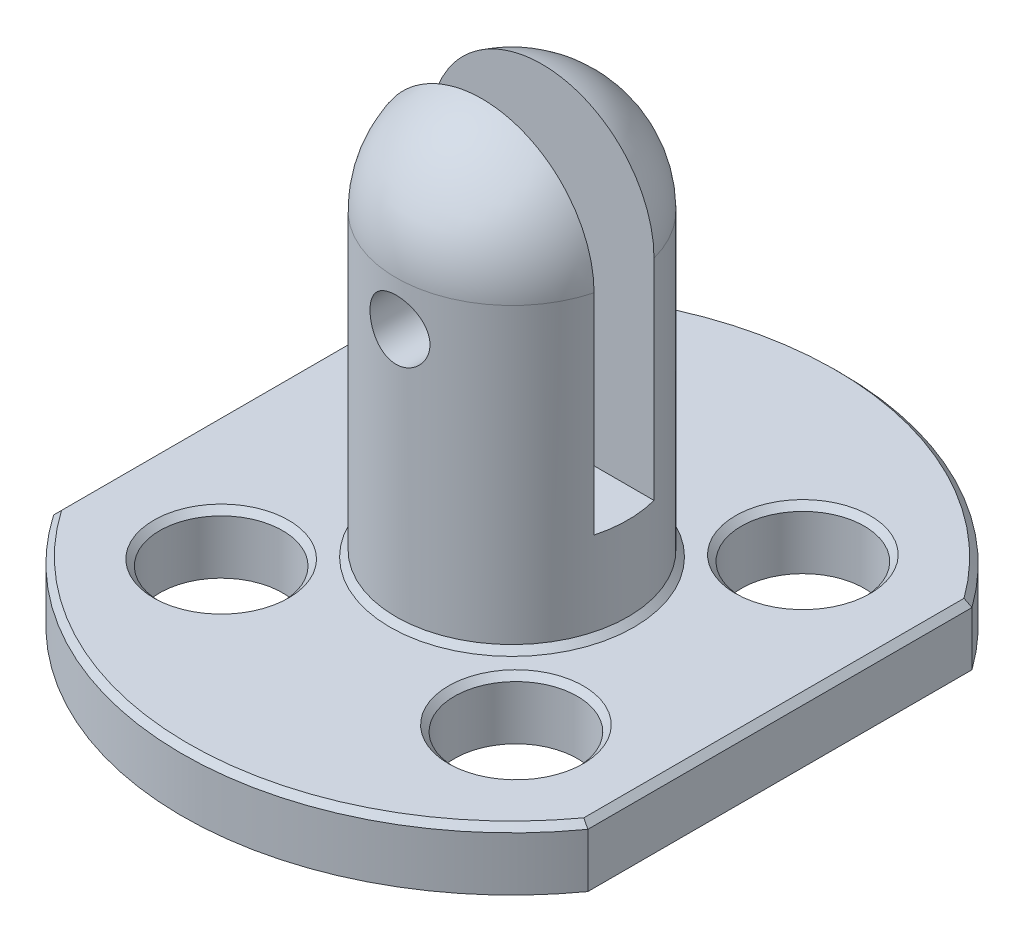
from build123d import *

# Parameters (mm, degrees)
SKETCH1_R               = 2.05
BOSS_EXTRUDE1_DEPTH     = 2
SKETCH2_R               = 3.87
BOSS_EXTRUDE2_DEPTH     = 10
SKETCH4_R               = 3
BOSS_EXTRUDE3_DEPTH     = 1
CUT_EXTRUDE2_DEPTH      = 15
CUT_EXTRUDE3_DEPTH      = 22.231780641
CUT_EXTRUDE3_DEPTH_BACK = 22.231780641
SKETCH9_R               = 1
CHAMFER1_SIZE           = 0.2


with BuildPart() as part:
    # Sketch1 → Boss-Extrude1 (new body)
    with BuildSketch(Plane(origin=(0, 0, 0), x_dir=(1, 0, 0), z_dir=(0, 1, 0))):
        with BuildLine():
            Line((-9.06012954, 6.238112913), (-9.06012954, -6.238112913))
            ThreePointArc((-9.06012954, -6.238112913), (-0.104590041, -10.999502758), (8.93987046, -6.40926799))
            Line((8.93987046, -6.40926799), (8.93987046, 6.40926799))
            ThreePointArc((8.93987046, 6.40926799), (-0.104590041, 10.999502758), (-9.06012954, 6.238112913))
        make_face()
        with Locations(Location((-4.917973081, 4.788086362, 0), (0, 0, 270))):
            Circle(SKETCH1_R, mode=Mode.SUBTRACT)
        with Locations(Location((4.788086362, 4.917973081, 0), (0, 0, 270))):
            Circle(SKETCH1_R, mode=Mode.SUBTRACT)
        with Locations(Location((4.917973081, -4.788086362, 0), (0, 0, 270))):
            Circle(SKETCH1_R, mode=Mode.SUBTRACT)
        with Locations(Location((-4.788086362, -4.917973081, 0), (0, 0, 270))):
            Circle(SKETCH1_R, mode=Mode.SUBTRACT)
    extrude(amount=BOSS_EXTRUDE1_DEPTH)

    # Sketch2 → Boss-Extrude2 (add)
    with BuildSketch(Plane(origin=(0, 2, 0), x_dir=(1, 0, 0), z_dir=(0, 1, 0))):
        with Locations(Location((0, 0, 0), (0, 0, 270))):
            Circle(SKETCH2_R)
    extrude(amount=BOSS_EXTRUDE2_DEPTH)

    # Sketch3 → Revolve1 (revolve)
    with BuildSketch(Plane.XY):
        with BuildLine():
            Line((0, 15.87), (0, 12))
            Line((0, 12), (3.87, 12))
            ThreePointArc((3.87, 12), (2.736503243, 14.736503243), (0, 15.87))
        make_face()
    revolve(axis=Axis((0, 15.87, 0), (0, -1, 0)))

    # Sketch4 → Boss-Extrude3 (add)
    with BuildSketch(Plane.XZ):
        with Locations(Location((0, 0, 0), (0, 0, 270))):
            Circle(SKETCH4_R)
    extrude(amount=BOSS_EXTRUDE3_DEPTH)

    # Sketch7 → Cut-Extrude2 (cut)
    with BuildSketch(Plane(origin=(0, 20, 0), x_dir=(1, 0, 0), z_dir=(0, 1, 0))):
        with BuildLine():
            Line((-7.332454233, 1), (7.579147316, 1))
            ThreePointArc((7.579147316, 1), (8.579147316, 0), (7.579147316, -1))
            Line((7.579147316, -1), (-7.332454233, -1))
            ThreePointArc((-7.332454233, -1), (-8.332454233, 0), (-7.332454233, 1))
        make_face()
    extrude(amount=-CUT_EXTRUDE2_DEPTH, mode=Mode.SUBTRACT)

    # Sketch9 → Cut-Extrude3 (cut, two sides: drawn at the far end of the back side and taken through both)
    with BuildSketch(Plane.XY.offset(-CUT_EXTRUDE3_DEPTH_BACK)):
        with Locations((0, 10.5)):
            Circle(SKETCH9_R)
    extrude(amount=CUT_EXTRUDE3_DEPTH + CUT_EXTRUDE3_DEPTH_BACK, mode=Mode.SUBTRACT)

    # Chamfer1
    chamfer1_edges = [part.edges().sort_by_distance(p)[0] for p in [
        (-4.917973081, 2, -6.838086362),
        (-0.104590041, 2, 10.999502758),
        (4.788086362, 2, -6.967973081),
        (8.93987046, 2, 0),
        (4.917973081, 2, 2.738086362),
        (-4.788086362, 2, 2.867973081),
        (0, 2, -3.87),
        (-0.104590041, 2, -10.999502758),
        (-9.06012954, 2, 0),
    ]]
    chamfer(chamfer1_edges, length=CHAMFER1_SIZE)


solid = part.part
